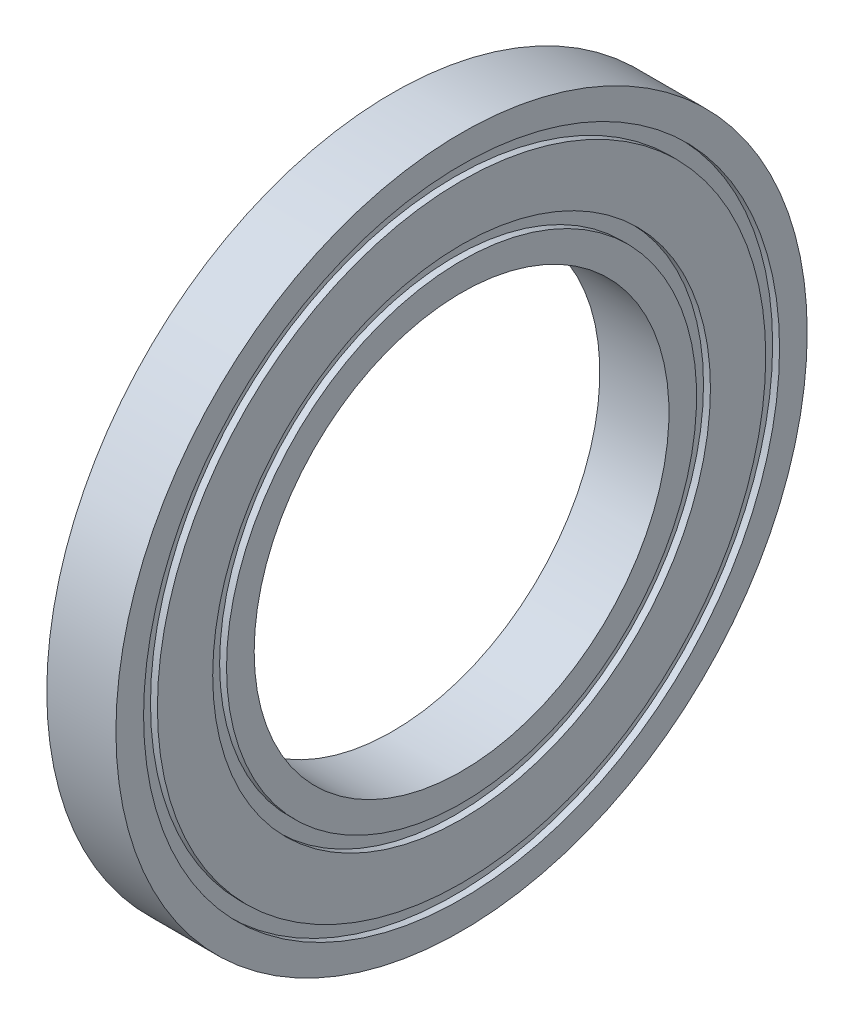
from build123d import *


with BuildPart() as part:
    # Sketch1 → Revolve1 (revolve)
    with BuildSketch(Plane.XY, mode=Mode.PRIVATE) as revolve1_sk:
        Polygon((-2.5, 25), (2.5, 25), (2.5, 23), (2, 23), (2, 22), (2.5, 22), (2.5, 18), (2, 18), (2, 17), (2.5, 17), (2.5, 15), (-2.5, 15), (-2.5, 17), (-2, 17), (-2, 18), (-2.5, 18), (-2.5, 22), (-2, 22), (-2, 23), (-2.5, 23), align=None)
    revolve(revolve1_sk.sketch.rotate(Axis((0, 0, 0), (1, 0, 0)), 90), axis=Axis((0, 0, 0), (1, 0, 0)))


solid = part.part
